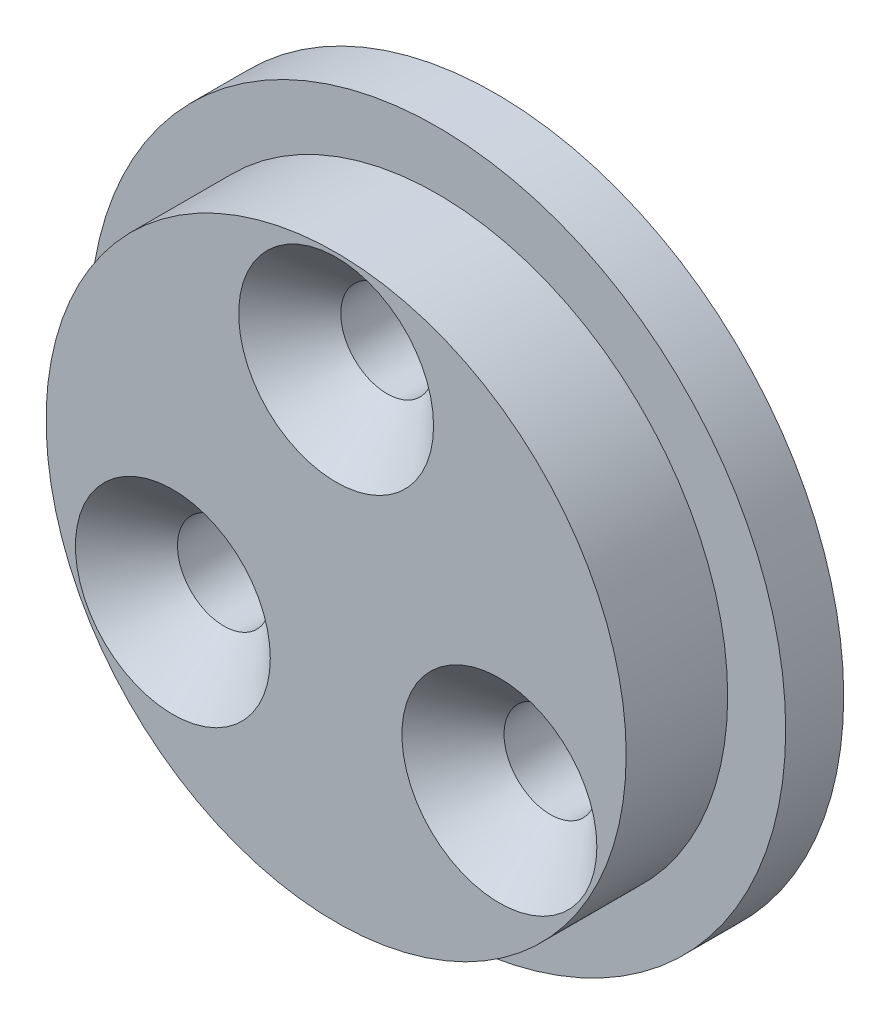
from build123d import *

# Parameters (mm, degrees)
CSK_FOR_M3_SFHCS1_D           = 3.2
CSK_FOR_M3_SFHCS1_CSINK_D     = 6.72
CSK_FOR_M3_SFHCS1_CSINK_ANGLE = 90
CHAMFER1_SIZE                 = 0.8


with BuildPart() as part:
    # Sketch1 → Revolve1 (revolve)
    with BuildSketch(Plane(origin=(0, 0, 0), x_dir=(1, 0, 0), z_dir=(0, 1, 0))):
        Polygon((0, 0), (3, 0), (3, 3), (9.5, 3), (9.5, 5), (12, 5), (12, 3), (10, 3), (10, -0.5), (0, -0.5), align=None)
    revolve(axis=Axis((0, 0, 0), (0, 0, -1)))

    # CSK for M3 SFHCS1 (through all)
    with Locations(Plane.XY.offset(0.5)):
        with Locations((0, 6.5), (5.629165125, -3.25), (-5.629165125, -3.25)):
            CounterSinkHole(CSK_FOR_M3_SFHCS1_D / 2, CSK_FOR_M3_SFHCS1_CSINK_D / 2, counter_sink_angle=CSK_FOR_M3_SFHCS1_CSINK_ANGLE)

    # Chamfer1
    chamfer1_edges = [part.edges().sort_by_distance(p)[0] for p in [
        (-9.5, 0, -5),
    ]]
    chamfer(chamfer1_edges, length=CHAMFER1_SIZE)


solid = part.part
